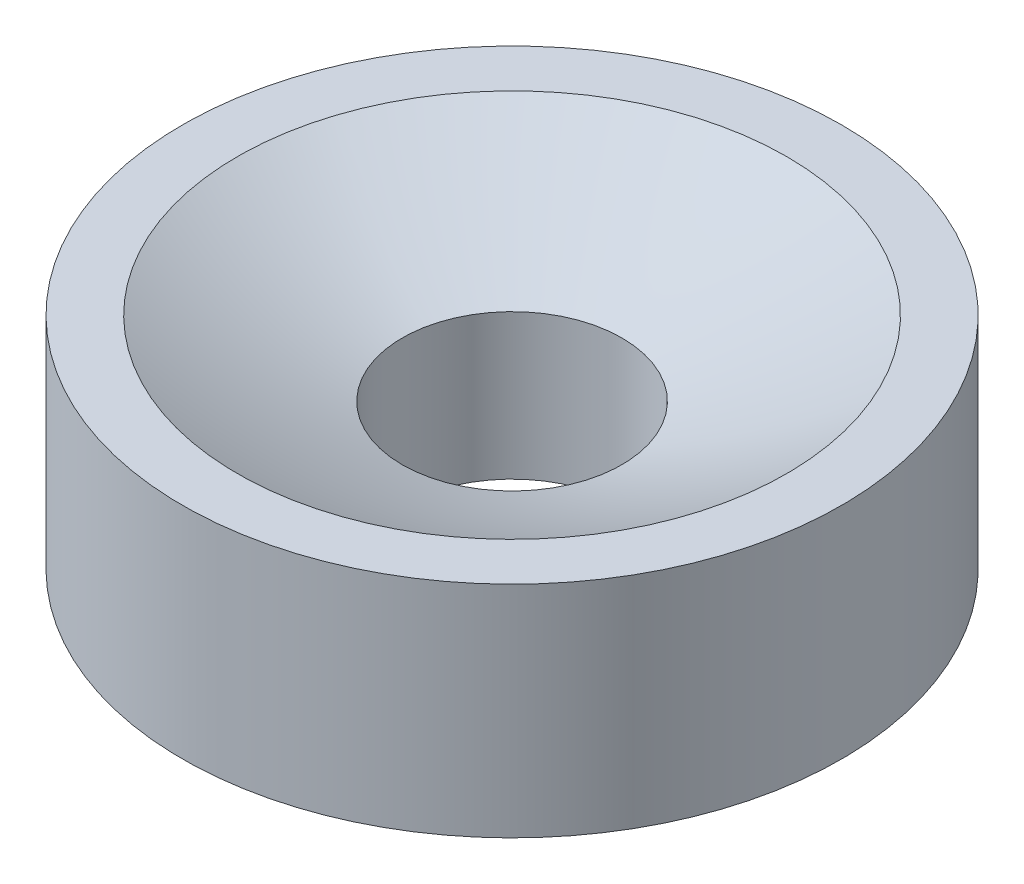
from build123d import *

# Parameters (mm, degrees)
SKETCH5_R          = 2
CUT_EXTRUDE4_DEPTH = 13


with BuildPart() as part:
    # Sketch4 → Revolve1 (revolve)
    with BuildSketch(Plane.XY, mode=Mode.PRIVATE) as revolve1_sk:
        with BuildLine():
            Line((0, 0), (6, 0))
            Line((6, 0), (6, 4))
            Line((6, 4), (5, 4))
            add(Edge.make_bspline(
                [(0, 2), (2.616573152, 2.711664356), (5, 4)],
                knots=[0, 0, 0, 1, 1, 1], degree=2))
            Line((0, 2), (0, 0))
        make_face()
    revolve(revolve1_sk.sketch.rotate(Axis((0, 0, 0), (0, 1, 0)), 90), axis=Axis((0, 0, 0), (0, 1, 0)))

    # Sketch5 → Cut-Extrude4 (cut)
    with BuildSketch(Plane(origin=(0, 0, 0), x_dir=(1, 0, 0), z_dir=(0, 1, 0))):
        with Locations(Location((0, 0, 0), (0, 0, 90))):
            Circle(SKETCH5_R)
    extrude(amount=CUT_EXTRUDE4_DEPTH, mode=Mode.SUBTRACT)


solid = part.part
